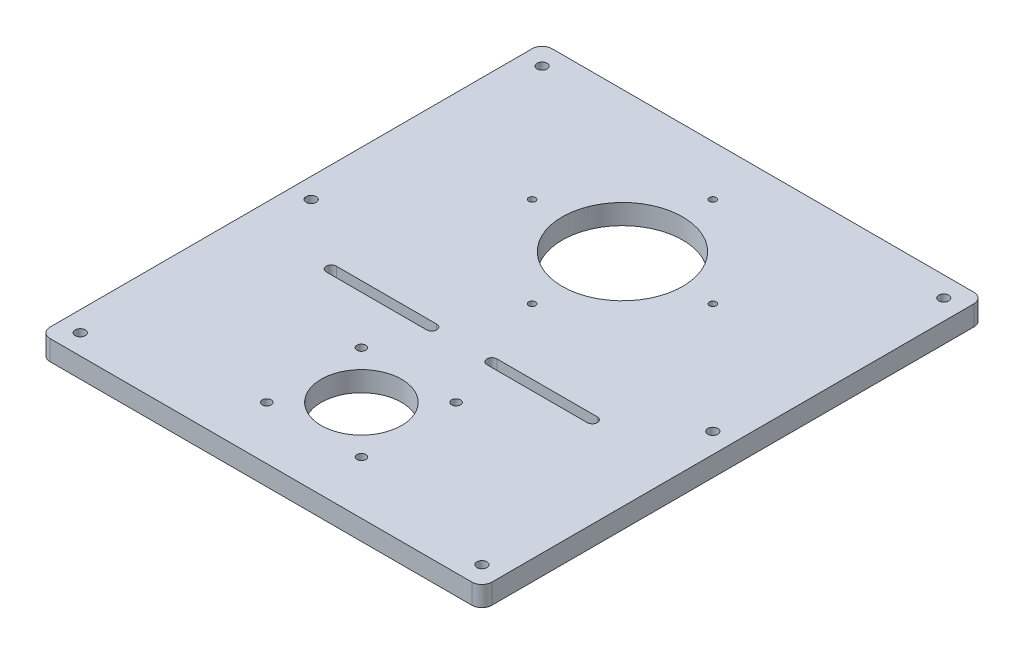
from build123d import *

# Parameters (mm, degrees)
SKETCH1_W               = 220
SKETCH1_H               = 250
SKETCH1_R               = 30
SKETCH1_R_2             = 20
SKETCH1_R_3             = 2.2
BOSS_EXTRUDE1_DEPTH     = 10
CUT_EXTRUDE1_DEPTH      = 212.187120819
CUT_EXTRUDE1_DEPTH_BACK = 212.187120819
SKETCH2_R               = 2.5
FILLET1_R               = 5
SKETCH4_R               = 1.7
CUT_EXTRUDE2_DEPTH      = 212.187120819
CIRPATTERN1_COUNT       = 4


with BuildPart() as part:
    # Sketch1 → Boss-Extrude1 (new body)
    with BuildSketch(Plane(origin=(0, 0, 0), x_dir=(1, 0, 0), z_dir=(0, 1, 0))):
        with Locations((0, -55)):
            Rectangle(SKETCH1_W, SKETCH1_H)
        with Locations(Location((0, 0, 0), (0, 0, 270))):
            Circle(SKETCH1_R, mode=Mode.SUBTRACT)
        with Locations(Location((0, -130, 0), (0, 0, 270))):
            Circle(SKETCH1_R_2, mode=Mode.SUBTRACT)
        with Locations(Location((-23.57, -106.43, 0), (0, 0, 270))):
            Circle(SKETCH1_R_3, mode=Mode.SUBTRACT)
        with Locations(Location((23.57, -106.43, 0), (0, 0, 270))):
            Circle(SKETCH1_R_3, mode=Mode.SUBTRACT)
        with Locations(Location((-23.57, -153.57, 0), (0, 0, 270))):
            Circle(SKETCH1_R_3, mode=Mode.SUBTRACT)
        with Locations(Location((23.57, -153.57, 0), (0, 0, 270))):
            Circle(SKETCH1_R_3, mode=Mode.SUBTRACT)
        with BuildLine():
            Line((-65, -77.5), (-15, -77.5))
            ThreePointArc((-15, -77.5), (-12.5, -80), (-15, -82.5))
            Line((-15, -82.5), (-65, -82.5))
            ThreePointArc((-65, -82.5), (-67.5, -80), (-65, -77.5))
        make_face(mode=Mode.SUBTRACT)
        with BuildLine():
            Line((65, -77.5), (15, -77.5))
            ThreePointArc((15, -77.5), (12.5, -80), (15, -82.5))
            Line((15, -82.5), (65, -82.5))
            ThreePointArc((65, -82.5), (67.5, -80), (65, -77.5))
        make_face(mode=Mode.SUBTRACT)
    extrude(amount=BOSS_EXTRUDE1_DEPTH)

    # Sketch2 → Cut-Extrude1 (cut, two sides: drawn at the far end of the back side and taken through both)
    with BuildSketch(Plane(origin=(0, 10, 0), x_dir=(1, 0, 0), z_dir=(0, 1, 0)).offset(-CUT_EXTRUDE1_DEPTH_BACK)):
        with Locations(Location((-100, 60, 0), (0, 0, 270))):
            Circle(SKETCH2_R)
        with Locations(Location((100, 60, 0), (0, 0, 270))):
            Circle(SKETCH2_R)
        with Locations(Location((-100, -170, 0), (0, 0, 270))):
            Circle(SKETCH2_R)
        with Locations(Location((100, -170, 0), (0, 0, 270))):
            Circle(SKETCH2_R)
        with Locations(Location((-100, -55, 0), (0, 0, 270))):
            Circle(SKETCH2_R)
        with Locations(Location((100, -55, 0), (0, 0, 270))):
            Circle(SKETCH2_R)
    extrude(amount=CUT_EXTRUDE1_DEPTH + CUT_EXTRUDE1_DEPTH_BACK, mode=Mode.SUBTRACT)

    # Fillet1
    fillet1_edges = [part.edges().sort_by_distance(p)[0] for p in [
        (-110, 5, -70),
        (110, 5, -70),
        (110, 5, 180),
        (-110, 5, 180),
    ]]
    fillet(fillet1_edges, radius=FILLET1_R)

    # Sketch4 → Cut-Extrude2 (cut, symmetric)
    with BuildSketch(Plane(origin=(0, 10, 0), x_dir=(1, 0, 0), z_dir=(0, 1, 0))):
        with Locations(Location((0, -45, 0), (0, 0, 270))):
            Circle(SKETCH4_R)
    cut_extrude2 = extrude(amount=CUT_EXTRUDE2_DEPTH, both=True, mode=Mode.SUBTRACT)

    # CirPattern1: Cut-Extrude2 ×4 about axis
    cirpattern1_axis = Axis((0, 0, 0), (0, 1, 0))
    for i in range(1, CIRPATTERN1_COUNT):
        add(cut_extrude2.rotate(cirpattern1_axis, i * 360 / CIRPATTERN1_COUNT), mode=Mode.SUBTRACT)


solid = part.part
